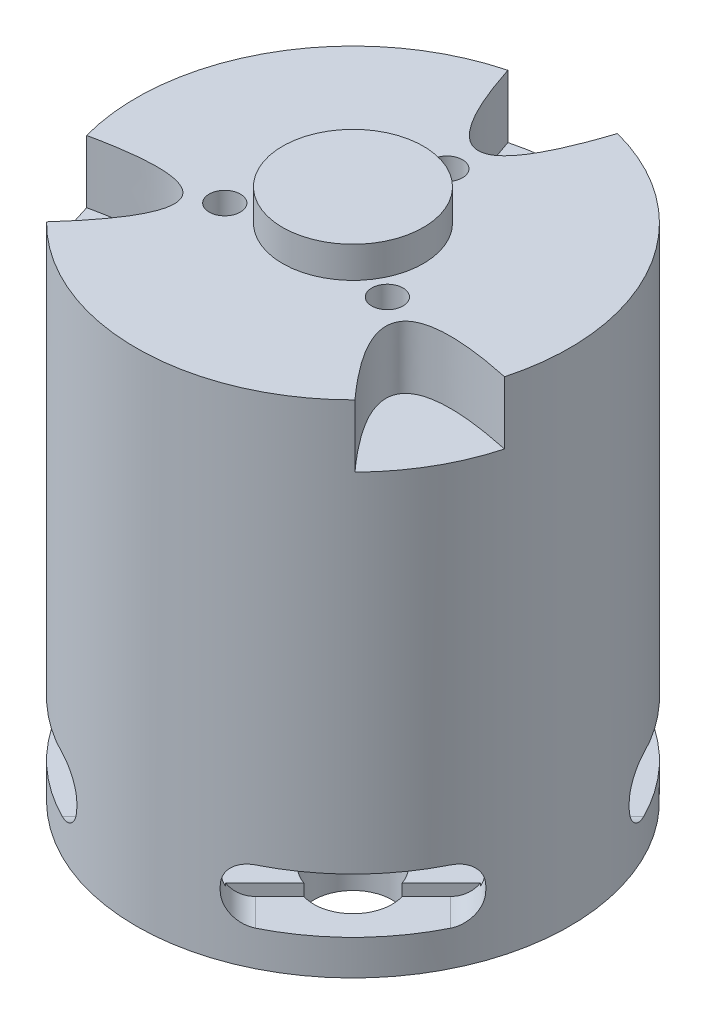
from build123d import *

# Parameters (mm, degrees)
SKETCH1_R           = 13.85
SKETCH1_R_2         = 1.5
SKETCH1_R_3         = 2.5
BOSS_EXTRUDE1_DEPTH = 3
SKETCH2_R           = 13.85
SKETCH2_R_2         = 12.35
BOSS_EXTRUDE2_DEPTH = 4
CUT_EXTRUDE1_DEPTH  = 3.2
CIRPATTERN1_COUNT   = 4
SKETCH4_R           = 13.85
BOSS_EXTRUDE3_DEPTH = 25
CUT_EXTRUDE2_START  = -4
SKETCH5_R           = 1
CUT_EXTRUDE2_DEPTH  = 4
SKETCH6_R           = 4.5
BOSS_EXTRUDE4_DEPTH = 2
SKETCH7_R           = 1.585
BOSS_EXTRUDE5_DEPTH = 3


with BuildPart() as part:
    # Sketch1 → Boss-Extrude1 (new body)
    with BuildSketch(Plane(origin=(0, 0, 0), x_dir=(1, 0, 0), z_dir=(0, 1, 0))):
        with Locations(Location((0, 0, 0), (0, 0, 270))):
            Circle(SKETCH1_R)
        with Locations(Location((0, 8, 0), (0, 0, 270))):
            Circle(SKETCH1_R_2, mode=Mode.SUBTRACT)
        with Locations(Location((-9.5, 0, 0), (0, 0, 270))):
            Circle(SKETCH1_R_2, mode=Mode.SUBTRACT)
        with Locations(Location((-6.717514421, 6.717514421, 0), (0, 0, 270))):
            Circle(SKETCH1_R_3, mode=Mode.SUBTRACT)
        with Locations(Location((6.717514421, 6.717514421, 0), (0, 0, 90))):
            Circle(SKETCH1_R_3, mode=Mode.SUBTRACT)
        with Locations(Location((9.5, 0, 0), (0, 0, 90))):
            Circle(SKETCH1_R_2, mode=Mode.SUBTRACT)
        with Locations(Location((6.717514421, -6.717514421, 0), (0, 0, 270))):
            Circle(SKETCH1_R_3, mode=Mode.SUBTRACT)
        with Locations(Location((0, -8, 0), (0, 0, 90))):
            Circle(SKETCH1_R_2, mode=Mode.SUBTRACT)
        with Locations(Location((-6.717514421, -6.717514421, 0), (0, 0, 90))):
            Circle(SKETCH1_R_3, mode=Mode.SUBTRACT)
    extrude(amount=BOSS_EXTRUDE1_DEPTH)

    # Sketch2 → Boss-Extrude2 (add)
    with BuildSketch(Plane(origin=(0, 3, 0), x_dir=(1, 0, 0), z_dir=(0, 1, 0))):
        with Locations(Location((0, 0, 0), (0, 0, 270))):
            Circle(SKETCH2_R)
        with Locations(Location((0, 0, 0), (0, 0, 270))):
            Circle(SKETCH2_R_2, mode=Mode.SUBTRACT)
    extrude(amount=BOSS_EXTRUDE2_DEPTH)

    # Sketch3 → Cut-Extrude1 (cut)
    with BuildSketch(Plane(origin=(-9.793428919, 0, 9.793428919), x_dir=(0, -1, 0), z_dir=(-0.7071067811865488, 0, 0.7071067811865464))):
        with BuildLine():
            Line((-4.15, 6), (-3.85, 6))
            ThreePointArc((-3.85, 6), (-2.71862915, 5.53137085), (-2.25, 4.4))
            Line((-2.25, 4.4), (-2.25, -4.4))
            ThreePointArc((-2.25, -4.4), (-2.71862915, -5.53137085), (-3.85, -6))
            Line((-3.85, -6), (-4.15, -6))
            ThreePointArc((-4.15, -6), (-5.28137085, -5.53137085), (-5.75, -4.4))
            Line((-5.75, -4.4), (-5.75, 4.4))
            ThreePointArc((-5.75, 4.4), (-5.28137085, 5.53137085), (-4.15, 6))
        make_face()
    cut_extrude1 = extrude(amount=-CUT_EXTRUDE1_DEPTH, mode=Mode.SUBTRACT)

    # CirPattern1: Cut-Extrude1 ×4 about axis
    cirpattern1_axis = Axis((0, 0, 0), (0, 1, 0))
    for i in range(1, CIRPATTERN1_COUNT):
        add(cut_extrude1.rotate(cirpattern1_axis, i * 360 / CIRPATTERN1_COUNT), mode=Mode.SUBTRACT)

    # Sketch4 → Boss-Extrude3 (add)
    with BuildSketch(Plane(origin=(0, 7, 0), x_dir=(1, 0, 0), z_dir=(0, 1, 0))):
        with Locations(Location((0, 0, 0), (0, 0, 270))):
            Circle(SKETCH4_R)
    extrude(amount=BOSS_EXTRUDE3_DEPTH)

    # Sketch5 → Cut-Extrude2 (cut)
    with BuildSketch(Plane(origin=(0, 32, 0), x_dir=(1, 0, 0), z_dir=(0, 1, 0)).offset(CUT_EXTRUDE2_START)):
        with Locations(Location((0, 6, 0), (0, 0, 270))):
            Circle(SKETCH5_R)
        with Locations(Location((5.196152423, -3, 0), (0, 0, 270))):
            Circle(SKETCH5_R)
        with Locations(Location((-5.196152423, -3, 0), (0, 0, 270))):
            Circle(SKETCH5_R)
        with BuildLine():
            ThreePointArc((-13.355144333, -3.669144292), (-11.994451842, -6.925), (-9.855144333, -9.731322118))
            add(Edge.make_bspline(
                [(-9.855144333, -9.731322118), (-2.251262127, -1.299766795), (-13.355144333, -3.669144292)],
                knots=[0, 0, 0, 1, 1, 1], degree=2))
        make_face()
        with BuildLine():
            ThreePointArc((3.5, 13.40046641), (0, 13.85), (-3.5, 13.40046641))
            add(Edge.make_bspline(
                [(-3.5, 13.40046641), (0, 2.59953359), (3.5, 13.40046641)],
                knots=[0, 0, 0, 1, 1, 1], degree=2))
        make_face()
        with BuildLine():
            ThreePointArc((9.855144333, -9.731322118), (11.994451842, -6.925), (13.355144333, -3.669144292))
            add(Edge.make_bspline(
                [(13.355144333, -3.669144292), (2.251262127, -1.299766795), (9.855144333, -9.731322118)],
                knots=[0, 0, 0, 1, 1, 1], degree=2))
        make_face()
    extrude(amount=CUT_EXTRUDE2_DEPTH, mode=Mode.SUBTRACT)

    # Sketch6 → Boss-Extrude4 (add)
    with BuildSketch(Plane(origin=(0, 32, 0), x_dir=(1, 0, 0), z_dir=(0, 1, 0))):
        with Locations(Location((0, 0, 0), (0, 0, 270))):
            Circle(SKETCH6_R)
    extrude(amount=BOSS_EXTRUDE4_DEPTH)

    # Sketch7 → Boss-Extrude5 (add)
    with BuildSketch(Plane.XZ):
        with Locations(Location((0, 0, 0), (0, 0, 90))):
            Circle(SKETCH7_R)
    extrude(amount=BOSS_EXTRUDE5_DEPTH)


solid = part.part
